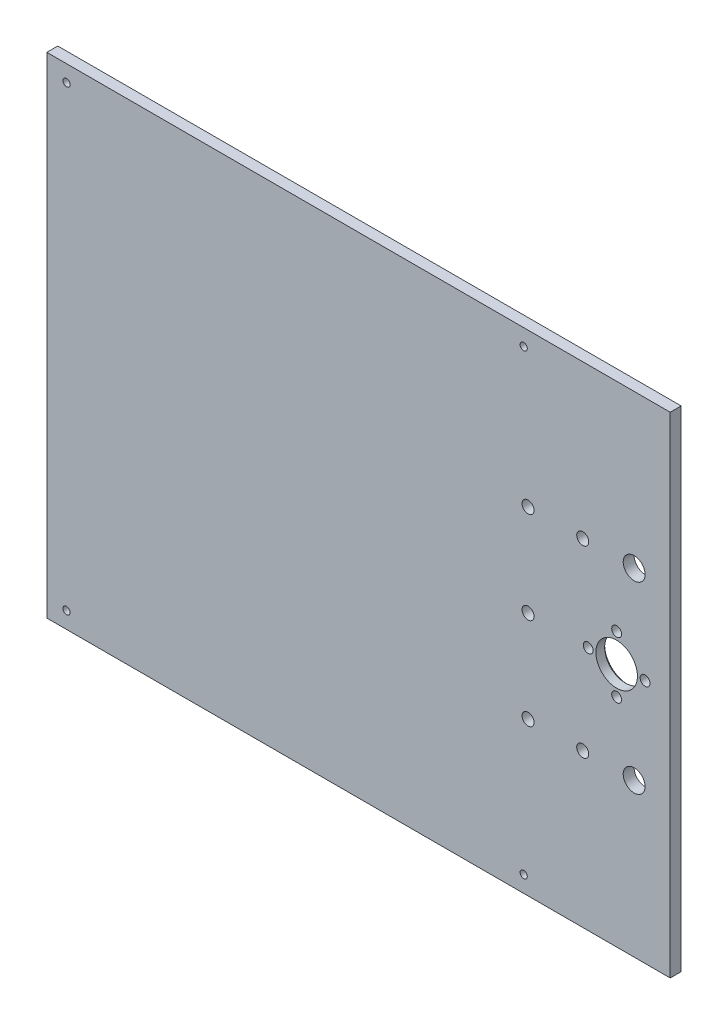
from build123d import *

# Parameters (mm, degrees)
SCHIZZO1_W                   = 285
SCHIZZO1_H                   = 224
ESTRUSIONE_ESTRUSIONE1_DEPTH = 5
TAGLIO_ESTRUSIONE1_REACH     = 377.215
SCHIZZO2_R                   = 9.5
SMUSSO1_SIZE                 = 1
FORO_PER_VITE_M4_1_D         = 4.5
FORO_PER_VITE_M4_1_DEPTH     = 8
FORO_PER_VITE_M4_1_TIP       = 1.351936393
TAGLIO_ESTRUSIONE2_REACH     = 377.215
SCHIZZO6_R                   = 5
FORO_PER_VITE_M5_2_D         = 5.5
FORO_PER_VITE_M5_2_DEPTH     = 5
FORO_FILETTATO_M4_1_D        = 3.3


with BuildPart() as part:
    # Schizzo1 → Estrusione-Estrusione1 (new body)
    with BuildSketch(Plane.XY):
        with Locations((-142.5, 132)):
            Rectangle(SCHIZZO1_W, SCHIZZO1_H)
    extrude(amount=ESTRUSIONE_ESTRUSIONE1_DEPTH)

    # Schizzo2 → Taglio-Estrusione1 (cut, up to next)
    with BuildSketch(Plane(origin=(0, 0, 0), x_dir=(-1, 0, 0), z_dir=(0, 0, -1)), mode=Mode.PRIVATE) as taglio_estrusione1_sk1:
        with Locations((24.5, 132)):
            Circle(SCHIZZO2_R)
    taglio_estrusione1_tool1 = extrude(taglio_estrusione1_sk1.sketch, amount=-TAGLIO_ESTRUSIONE1_REACH, mode=Mode.PRIVATE) & part.part
    add(taglio_estrusione1_tool1.solids().sort_by_distance((-24.5, 132, 0))[0], mode=Mode.SUBTRACT)

    # Smusso1
    smusso1_edges = [part.edges().sort_by_distance(p)[0] for p in [
        (-15, 132, 0),
    ]]
    chamfer(smusso1_edges, length=SMUSSO1_SIZE)

    # Foro per Vite M4-1
    with Locations(Plane(origin=(0, 0, 0), x_dir=(-1, 0, 0), z_dir=(0, 0, -1))):
        with Locations((24.5, 119), (37.5, 132), (24.5, 145), (11.5, 132)):
            Hole(FORO_PER_VITE_M4_1_D / 2, depth=FORO_PER_VITE_M4_1_DEPTH)
            with Locations((0, 0, -(FORO_PER_VITE_M4_1_DEPTH + FORO_PER_VITE_M4_1_TIP / 2))):  # 118° drill point
                Cone(0, FORO_PER_VITE_M4_1_D / 2, FORO_PER_VITE_M4_1_TIP, mode=Mode.SUBTRACT)

    # Schizzo6 → Taglio-Estrusione2 (cut, up to next)
    with BuildSketch(Plane.XY.offset(5), mode=Mode.PRIVATE) as taglio_estrusione2_sk1:
        with Locations((-16.5, 90)):
            Circle(SCHIZZO6_R)
    taglio_estrusione2_tool1 = extrude(taglio_estrusione2_sk1.sketch, amount=-TAGLIO_ESTRUSIONE2_REACH, mode=Mode.PRIVATE) & part.part
    # Schizzo6 → Taglio-Estrusione2 (cut, up to next)
    with BuildSketch(Plane.XY.offset(5), mode=Mode.PRIVATE) as taglio_estrusione2_sk2:
        with Locations((-16.5, 174)):
            Circle(SCHIZZO6_R)
    taglio_estrusione2_tool2 = extrude(taglio_estrusione2_sk2.sketch, amount=-TAGLIO_ESTRUSIONE2_REACH, mode=Mode.PRIVATE) & part.part
    add(taglio_estrusione2_tool1.solids().sort_by_distance((-16.5, 90, 5))[0], mode=Mode.SUBTRACT)
    add(taglio_estrusione2_tool2.solids().sort_by_distance((-16.5, 174, 5))[0], mode=Mode.SUBTRACT)

    # Foro per Vite M5-2
    with Locations(Plane.XY.offset(5)):
        with Locations((-27.952976608, 298.668851704), (-40, 90), (-65, 132), (-40, 174), (-65, 174), (-65, 90)):
            Hole(FORO_PER_VITE_M5_2_D / 2, depth=FORO_PER_VITE_M5_2_DEPTH)

    # Foro filettato M4-1 (through all)
    with Locations(Plane(origin=(0, 0, 0), x_dir=(-1, 0, 0), z_dir=(0, 0, -1))):
        with Locations((276, 27.5), (67, 27.5), (276, 236.5), (67, 236.5)):
            Hole(FORO_FILETTATO_M4_1_D / 2)


solid = part.part
